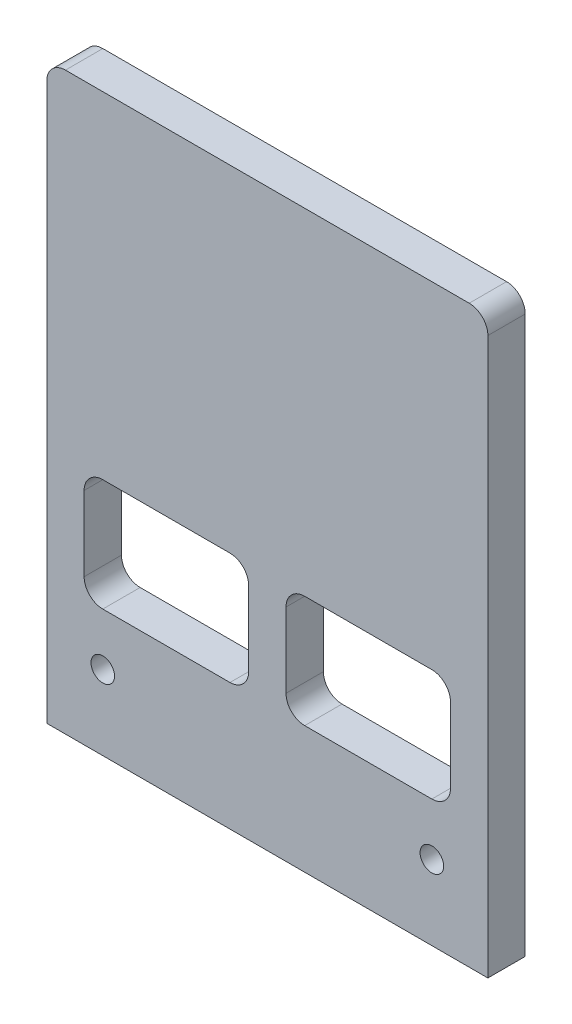
from build123d import *

# Parameters (mm, degrees)
SKETCH1_W           = 75
SKETCH1_H           = 100.95000003
BOSS_EXTRUDE1_DEPTH = 6.35
SKETCH3_R           = 2
CUT_EXTRUDE1_DEPTH  = 6.35
SKETCH4_W           = 75
SKETCH4_H           = 3.175
CUT_EXTRUDE2_DEPTH  = 64.20045986
FILLET1_R           = 3.175
SKETCH5_W           = 27.975
SKETCH5_H           = 19.05
CUT_EXTRUDE3_DEPTH  = 64.20045986
FILLET2_R           = 3.175


with BuildPart() as part:
    # Sketch1 → Boss-Extrude1 (new body)
    with BuildSketch(Plane.XY):
        Rectangle(SKETCH1_W, SKETCH1_H)
    extrude(amount=BOSS_EXTRUDE1_DEPTH)

    # Sketch3 → Cut-Extrude1 (cut)
    with BuildSketch(Plane.XY.offset(6.35)):
        with Locations((-27.975, -37.775000015)):
            Circle(SKETCH3_R)
        with Locations((27.975, -37.775000015)):
            Circle(SKETCH3_R)
    extrude(amount=-CUT_EXTRUDE1_DEPTH, mode=Mode.SUBTRACT)

    # Sketch4 → Cut-Extrude2 (cut, through all)
    with BuildSketch(Plane(origin=(0, 0, 0), x_dir=(-1, 0, 0), z_dir=(0, 0, -1))):
        with Locations((0, 48.887500015)):
            Rectangle(SKETCH4_W, SKETCH4_H)
    extrude(amount=-CUT_EXTRUDE2_DEPTH, mode=Mode.SUBTRACT)

    # Fillet1
    fillet1_edges = [part.edges().sort_by_distance(p)[0] for p in [
        (37.5, 47.300000015, 3.175),
        (-37.5, 47.300000015, 3.175),
    ]]
    fillet(fillet1_edges, radius=FILLET1_R)

    # Sketch5 → Cut-Extrude3 (cut, through all)
    with BuildSketch(Plane(origin=(0, 0, 0), x_dir=(-1, 0, 0), z_dir=(0, 0, -1))):
        with Locations((-17.1625, -19.360000015)):
            Rectangle(SKETCH5_W, SKETCH5_H)
        with Locations((17.1625, -19.360000015)):
            Rectangle(SKETCH5_W, SKETCH5_H)
    extrude(amount=-CUT_EXTRUDE3_DEPTH, mode=Mode.SUBTRACT)

    # Fillet2
    fillet2_edges = [part.edges().sort_by_distance(p)[0] for p in [
        (31.15, -28.885000015, 3.175),
        (31.15, -9.835000015, 3.175),
        (3.175, -9.835000015, 3.175),
        (3.175, -28.885000015, 3.175),
        (-3.175, -28.885000015, 3.175),
        (-3.175, -9.835000015, 3.175),
        (-31.15, -9.835000015, 3.175),
        (-31.15, -28.885000015, 3.175),
    ]]
    fillet(fillet2_edges, radius=FILLET2_R)


solid = part.part
